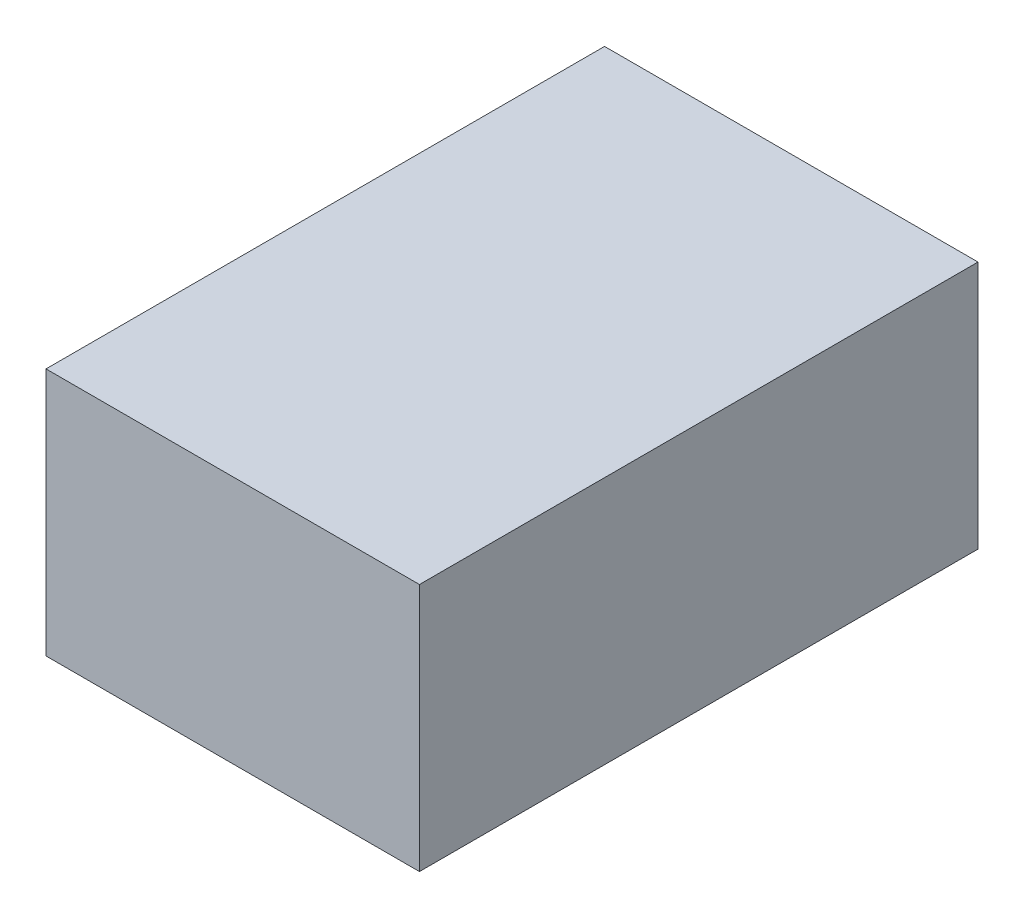
from build123d import *

# Parameters (mm, degrees)
SKETCH1_W      = 67.9323
SKETCH1_H      = 45.2247
EXTRUDE1_DEPTH = 101.6


with BuildPart() as part:
    # Sketch1 → Extrude1 (new body)
    with BuildSketch(Plane.XY):
        Rectangle(SKETCH1_W, SKETCH1_H)
    extrude(amount=-EXTRUDE1_DEPTH)


solid = part.part
